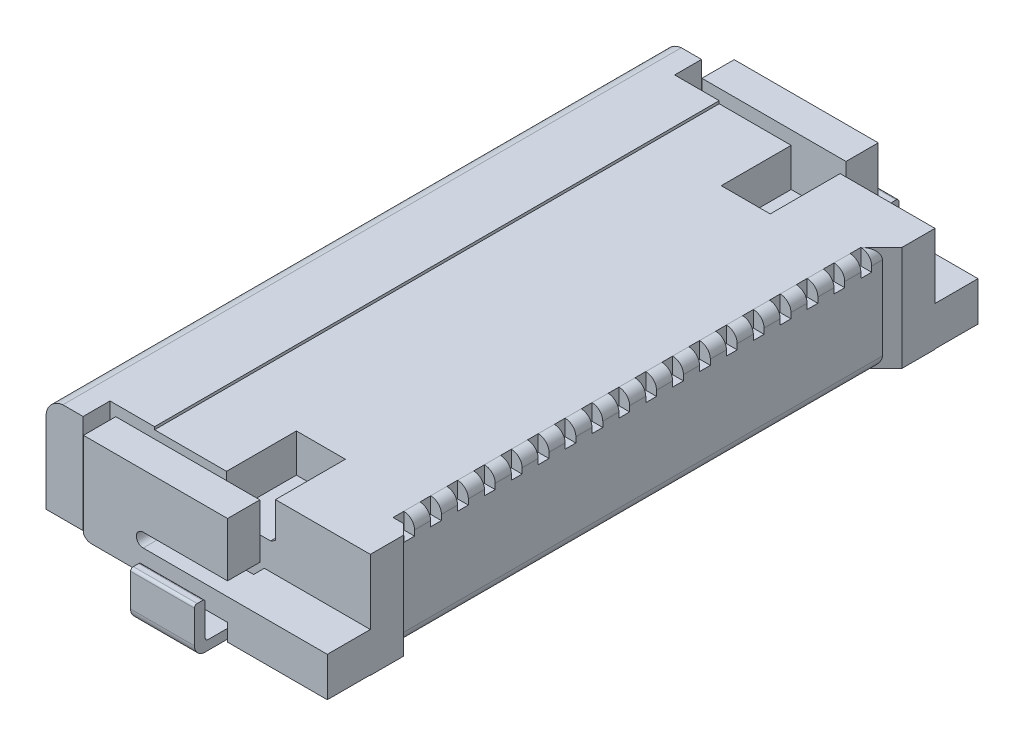
from build123d import *

# Parameters (mm, degrees)
BOSS_EXTRUDE1_DEPTH  = 0.6
BOSS_EXTRUDE2_DEPTH  = 0.8
SKETCH8_W            = 1.187106534
SKETCH8_H            = 0.413578876
BOSS_EXTRUDE3_DEPTH  = 0.6
BOSS_EXTRUDE5_DEPTH  = 1.999195913
CUT_EXTRUDE6_DEPTH   = 1.3
SKETCH19_W           = 5.25
SKETCH19_H           = 1.999195913
BOSS_EXTRUDE6_DEPTH  = 0.963004
BOSS_EXTRUDE7_DEPTH  = 5.25
CUT_EXTRUDE7_DEPTH   = 5.25
BOSS_EXTRUDE8_DEPTH  = 0.5
CUT_EXTRUDE8_DEPTH   = 0.05
FILLET4_R            = 0.2
BOSS_EXTRUDE9_DEPTH  = 0.5
SKETCH27_W           = 1.187106534
SKETCH27_H           = 0.682337146
BOSS_EXTRUDE10_DEPTH = 0.2
FILLET6_R            = 0.2
FILLET7_R            = 0.05
BOSS_EXTRUDE11_DEPTH = 1.187106534
FILLET6_OF_MIRROR6_R = 0.2
FILLET7_OF_MIRROR6_R = 0.05
FILLET8_R            = 0.05
FILLET9_R            = 0.05
SKETCH34_W           = 1.386527719
SKETCH34_H           = 0.2
CUT_EXTRUDE9_DEPTH   = 0.3
CUT_EXTRUDE10_DEPTH  = 0.68797799
SKETCH37_W           = 0.2
SKETCH37_H           = 0.52
BOSS_EXTRUDE12_DEPTH = 0.05
SKETCH38_W           = 0.2
SKETCH38_H           = 0.170876034
BOSS_EXTRUDE13_DEPTH = 0.01
LPATTERN2_COUNT      = 18
LPATTERN2_PITCH      = 0.5


with BuildPart() as part:
    # Sketch5 → Boss-Extrude1 (new body)
    with BuildSketch(Plane.XY):
        with BuildLine():
            Line((1.03647469, 0.909619652), (1.03647469, 0.476981472))
            add(Edge.make_bspline(
                [(1.184733339, 0.385802819), (1.081992039, 0.388557453), (1.03647469, 0.476981472)],
                knots=[0, 0, 0, 1, 1, 1], degree=2))
            Line((1.184733339, 0.385802819), (2.412634415, 0.385802819))
            Line((2.412634415, 0.385802819), (2.412634415, 0.799381695))
            Line((2.412634415, 0.799381695), (2.14625929, 0.799381695))
            ThreePointArc((2.14625929, 0.799381695), (2.018862492, 0.926778494), (2.14625929, 1.054175292))
            Line((2.14625929, 1.054175292), (3.715556221, 1.054175292))
            Line((3.715556221, 1.054175292), (3.715556221, 1.297888432))
            Line((3.715556221, 1.297888432), (3.715556221, 2.059195913))
            Line((3.715556221, 2.059195913), (1.03647469, 2.059195913))
            Line((1.03647469, 2.059195913), (1.03647469, 1.21340623))
            Line((1.03647469, 1.21340623), (1.03647469, 0.909619652))
        make_face()
    boss_extrude1 = extrude(amount=-BOSS_EXTRUDE1_DEPTH)



with BuildPart() as body_2:
    # Sketch7 → Boss-Extrude2 (new body)
    with BuildSketch(Plane.XY):
        Polygon((3.715556221, 0.067073076), (5.570517707, 0.067073076), (5.570517707, 0.174952185), (5.570517707, 0.799381695), (3.599740949, 0.799381695), (3.599740949, 0.385802819), (3.715556221, 0.385802819), (3.715556221, 0.174952185), align=None)
    boss_extrude2 = extrude(amount=-BOSS_EXTRUDE2_DEPTH)


with BuildPart() as part_1:
    add(part.part)

    add(body_2.part)  # Boss-Extrude3 merges body 2
    # Sketch8 → Boss-Extrude3 (add)
    with BuildSketch(Plane.XY):
        with Locations((3.006187682, 0.592592257)):
            Rectangle(SKETCH8_W, SKETCH8_H)
    boss_extrude3 = extrude(amount=-BOSS_EXTRUDE3_DEPTH)

    # Sketch13 → Boss-Extrude5 (add)
    with BuildSketch(Plane(origin=(0, 0.06, 0), x_dir=(1, 0, 0), z_dir=(0, 1, 0))):
        Polygon((5.307650665, 6.05), (1.692449276, 6.05), (1.692449276, 0.8), (5.570517707, 0.8), (5.570517707, 1.413103506), (5.3880831, 1.595538113), (5.3880831, 6.05), align=None)
    boss_extrude5 = extrude(amount=BOSS_EXTRUDE5_DEPTH)

    # Sketch17 → Cut-Extrude6 (cut)
    with BuildSketch(Plane.XY.offset(-0.8)):
        Polygon((3.806395908, 1.34820616), (3.715556221, 1.297888432), (2.896280475, 1.297888432), (2.896280475, 2.059195913), (3.806395908, 2.059195913), align=None)
    cut_extrude6 = extrude(amount=-CUT_EXTRUDE6_DEPTH, mode=Mode.SUBTRACT)



with BuildPart() as body_2_2:
    # Sketch19 → Boss-Extrude6 (new body)
    with BuildSketch(Plane.ZY.offset(-1.692449276)):
        with Locations((-3.425, 1.059597956)):
            Rectangle(SKETCH19_W, SKETCH19_H)
    boss_extrude6 = extrude(amount=BOSS_EXTRUDE6_DEPTH)

    # Sketch18 → Boss-Extrude7 (add)
    with BuildSketch(Plane.XY.offset(-0.8)):
        with BuildLine():
            Line((0.041467015, 1.670216776), (0.041467015, 0.219865316))
            Line((0.041467015, 0.219865316), (0.729445005, 0.219865316))
            Line((0.729445005, 0.219865316), (0.729445005, 0.909619652))
            Line((0.729445005, 0.909619652), (0.729445005, 2.059195913))
            Line((0.729445005, 2.059195913), (0.352729657, 2.059195913))
            ThreePointArc((0.352729657, 2.059195913), (0.116538119, 1.929170948), (0.041467015, 1.670216776))
        make_face()
    boss_extrude7 = extrude(amount=-BOSS_EXTRUDE7_DEPTH)

    # Sketch20 → Cut-Extrude7 (cut)
    with BuildSketch(Plane.XY.offset(-0.8)):
        Polygon((1.03647469, 0.067073076), (1.03647469, 0.909619652), (0.729445005, 0.909619652), (0.729445005, 0.219865316), (0.729445005, 0.06), (0.729445005, -0.020267982), (1.03647469, -0.020267982), align=None)
    cut_extrude7 = extrude(amount=-CUT_EXTRUDE7_DEPTH, mode=Mode.SUBTRACT)

    # Sketch21 → Boss-Extrude8 (add)
    with BuildSketch(Plane.XY.offset(-0.8)):
        with BuildLine():
            Line((0.729445005, 0.219865316), (0.729445005, 0.909619652))
            Line((0.729445005, 0.909619652), (0.729445005, 2.059195913))
            Line((0.729445005, 2.059195913), (0.352729657, 2.059195913))
            ThreePointArc((0.352729657, 2.059195913), (0.116538119, 1.929170948), (0.041467015, 1.670216776))
            Line((0.041467015, 1.670216776), (0.041467015, 0.219865316))
            Line((0.041467015, 0.219865316), (0.729445005, 0.219865316))
        make_face()
    boss_extrude8 = extrude(amount=BOSS_EXTRUDE8_DEPTH)


with BuildPart() as part_2:
    add(part_1.part)

    add(body_2_2.part)  # Mirror1 merges body 2 2
    # Mirror1: Boss-Extrude1, Boss-Extrude2, Boss-Extrude3, Boss-Extrude5 across Plane3
    add(boss_extrude1.mirror(Plane.XY.offset(-6.05)))
    add(boss_extrude2.mirror(Plane.XY.offset(-6.05)))
    add(boss_extrude3.mirror(Plane.XY.offset(-6.05)))
    add(boss_extrude5.mirror(Plane.XY.offset(-6.05)))

    # Mirror1 2: Cut-Extrude6 across Plane3
    add(cut_extrude6.mirror(Plane.XY.offset(-6.05)), mode=Mode.SUBTRACT)

    # Mirror1 3: Boss-Extrude6, Boss-Extrude7 across Plane3
    add(boss_extrude6.mirror(Plane.XY.offset(-6.05)))
    add(boss_extrude7.mirror(Plane.XY.offset(-6.05)))

    # Mirror1 4: Cut-Extrude7 across Plane3
    add(cut_extrude7.mirror(Plane.XY.offset(-6.05)), mode=Mode.SUBTRACT)

    # Mirror1 5: Boss-Extrude8 across Plane3
    add(boss_extrude8.mirror(Plane.XY.offset(-6.05)))

    # Sketch22 → Cut-Extrude8 (cut)
    with BuildSketch(Plane(origin=(0, 2.059195913, 0), x_dir=(1, 0, 0), z_dir=(0, 1, 0))):
        Polygon((2.896280475, 11.3), (1.558180163, 11.3), (1.558180163, 0.8), (2.896280475, 0.8), (2.896280475, 2.1), (3.806395908, 2.1), (3.806395908, 0.8), (5.570517707, 0.8), (5.570517707, 1.413103506), (5.3880831, 1.595538113), (5.3880831, 10.504461887), (5.570517707, 10.686896494), (5.570517707, 11.3), (3.806395908, 11.3), (3.806395908, 10), (2.896280475, 10), align=None)
    extrude(amount=-CUT_EXTRUDE8_DEPTH, mode=Mode.SUBTRACT)

    # Fillet4
    fillet4_edges = [part_2.edges().sort_by_distance(p)[0] for p in [
        (5.3880831, 0.06, -6.05),
        (5.3880831, 2.009195913, -6.05),
    ]]
    fillet(fillet4_edges, radius=FILLET4_R)



with BuildPart() as body_2_3:
    # Sketch26 → Boss-Extrude9 (new body)
    with BuildSketch(Plane.XY):
        Polygon((2.412634415, 0.174952185), (2.412634415, 0.067073076), (2.412634415, 0), (3.599740949, 0), (3.599740949, 0.067073076), (3.599740949, 0.174952185), align=None)
    boss_extrude9 = extrude(amount=BOSS_EXTRUDE9_DEPTH)

    # Sketch27 → Boss-Extrude10 (add)
    with BuildSketch(Plane.XY.offset(0.5)):
        with Locations((3.006187682, 0.516120758)):
            Rectangle(SKETCH27_W, SKETCH27_H)
    boss_extrude10 = extrude(amount=-BOSS_EXTRUDE10_DEPTH)

    # Fillet6
    fillet6_edges = [body_2_3.edges().sort_by_distance(p)[0] for p in [
        (3.006187682, 0, 0.5),
    ]]
    fillet(fillet6_edges, radius=FILLET6_R)

    # Fillet7
    fillet7_edges = [body_2_3.edges().sort_by_distance(p)[0] for p in [
        (3.006187682, 0.857289331, 0.3),
        (3.006187682, 0.857289331, 0.5),
    ]]
    fillet(fillet7_edges, radius=FILLET7_R)


with BuildPart() as part_3:
    add(part_2.part)

    add(body_2_3.part)  # Boss-Extrude11 merges body 2 3
    # Sketch28 → Boss-Extrude11 (add)
    with BuildSketch(Plane.ZY.offset(-2.412634415)):
        with BuildLine():
            Line((-0.8, 0.323306936), (-0.8, 0.139277214))
            ThreePointArc((-0.8, 0.139277214), (-0.690012763, 0.045403916), (-0.552725208, 0))
            Line((-0.552725208, 0), (0, 0))
            Line((0, 0), (0, 0.174952185))
            Line((0, 0.174952185), (-0.552725208, 0.174952185))
            ThreePointArc((-0.552725208, 0.174952185), (-0.689100625, 0.227898076), (-0.8, 0.323306936))
        make_face()
    boss_extrude11 = extrude(amount=-BOSS_EXTRUDE11_DEPTH)

    # Mirror6: Boss-Extrude9, Boss-Extrude10, Boss-Extrude11 across plane
    add(boss_extrude9.mirror(Plane.XY.offset(-6.05)))
    add(boss_extrude10.mirror(Plane.XY.offset(-6.05)))
    add(boss_extrude11.mirror(Plane.XY.offset(-6.05)))

    # Fillet6 of Mirror6
    fillet6_of_mirror6_edges = [part_3.edges().sort_by_distance(p)[0] for p in [
        (3.006187682, 0, -12.6),
    ]]
    fillet(fillet6_of_mirror6_edges, radius=FILLET6_OF_MIRROR6_R)

    # Fillet7 of Mirror6
    fillet7_of_mirror6_edges = [part_3.edges().sort_by_distance(p)[0] for p in [
        (3.006187682, 0.857289331, -12.4),
        (3.006187682, 0.857289331, -12.6),
    ]]
    fillet(fillet7_of_mirror6_edges, radius=FILLET7_OF_MIRROR6_R)

    # Fillet8
    fillet8_edges = [part_3.edges().sort_by_distance(p)[0] for p in [
        (3.006187682, 0.174952185, 0.3),
    ]]
    fillet(fillet8_edges, radius=FILLET8_R)

    # Fillet9
    fillet9_edges = [part_3.edges().sort_by_distance(p)[0] for p in [
        (3.006187682, 0.174952185, -12.4),
    ]]
    fillet(fillet9_edges, radius=FILLET9_R)

    # Sketch34 → Cut-Extrude9 (cut)
    with BuildSketch(Plane(origin=(0, 2.009195913, 0), x_dir=(1, 0, 0), z_dir=(0, 1, 0))):
        with Locations((5.88134696, 9.704461887)):
            Rectangle(SKETCH34_W, SKETCH34_H)
        with Locations((5.88134696, 10.204461887)):
            Rectangle(SKETCH34_W, SKETCH34_H)
        with Locations((5.88134696, 9.204461887)):
            Rectangle(SKETCH34_W, SKETCH34_H)
        with Locations((5.88134696, 8.704461887)):
            Rectangle(SKETCH34_W, SKETCH34_H)
        with Locations((5.88134696, 8.204461887)):
            Rectangle(SKETCH34_W, SKETCH34_H)
        with Locations((5.88134696, 7.704461887)):
            Rectangle(SKETCH34_W, SKETCH34_H)
        with Locations((5.88134696, 7.204461887)):
            Rectangle(SKETCH34_W, SKETCH34_H)
        with Locations((5.88134696, 6.704461887)):
            Rectangle(SKETCH34_W, SKETCH34_H)
        with Locations((5.88134696, 6.204461887)):
            Rectangle(SKETCH34_W, SKETCH34_H)
        with Locations((5.88134696, 5.704461887)):
            Rectangle(SKETCH34_W, SKETCH34_H)
        with Locations((5.88134696, 5.204461887)):
            Rectangle(SKETCH34_W, SKETCH34_H)
        with Locations((5.88134696, 4.704461887)):
            Rectangle(SKETCH34_W, SKETCH34_H)
        with Locations((5.88134696, 4.204461887)):
            Rectangle(SKETCH34_W, SKETCH34_H)
        with Locations((5.88134696, 3.704461887)):
            Rectangle(SKETCH34_W, SKETCH34_H)
        with Locations((5.88134696, 3.204461887)):
            Rectangle(SKETCH34_W, SKETCH34_H)
        with Locations((5.88134696, 2.704461887)):
            Rectangle(SKETCH34_W, SKETCH34_H)
        with Locations((5.88134696, 2.204461887)):
            Rectangle(SKETCH34_W, SKETCH34_H)
        with Locations((5.88134696, 1.704461887)):
            Rectangle(SKETCH34_W, SKETCH34_H)
    extrude(amount=-CUT_EXTRUDE9_DEPTH, mode=Mode.SUBTRACT)

    # Sketch35 → Cut-Extrude10 (cut)
    with BuildSketch(Plane.ZY.offset(-0.041467015)):
        Polygon((-10.835, 0.219865316), (-10.835, 0.909619652), (-9.505, 0.909619652), (-9.505, 1.229619652), (-2.595, 1.229619652), (-2.595, 0.909619652), (-1.265, 0.909619652), (-1.265, 0.219865316), align=None)
    extrude(amount=-CUT_EXTRUDE10_DEPTH, mode=Mode.SUBTRACT)

    # Sketch37 → Boss-Extrude12 (add)
    with BuildSketch(Plane.ZY.offset(-1.03647469)):
        with Locations((-10.285, 0.649619652)):
            Rectangle(SKETCH37_W, SKETCH37_H)
        with Locations((-9.785, 0.649619652)):
            Rectangle(SKETCH37_W, SKETCH37_H)
        with Locations((-9.285, 0.649619652)):
            Rectangle(SKETCH37_W, SKETCH37_H)
        with Locations((-8.785, 0.649619652)):
            Rectangle(SKETCH37_W, SKETCH37_H)
        with Locations((-8.285, 0.649619652)):
            Rectangle(SKETCH37_W, SKETCH37_H)
        with Locations((-7.785, 0.649619652)):
            Rectangle(SKETCH37_W, SKETCH37_H)
        with Locations((-7.285, 0.649619652)):
            Rectangle(SKETCH37_W, SKETCH37_H)
        with Locations((-6.785, 0.649619652)):
            Rectangle(SKETCH37_W, SKETCH37_H)
        with Locations((-6.285, 0.649619652)):
            Rectangle(SKETCH37_W, SKETCH37_H)
        with Locations((-5.785, 0.649619652)):
            Rectangle(SKETCH37_W, SKETCH37_H)
        with Locations((-5.285, 0.649619652)):
            Rectangle(SKETCH37_W, SKETCH37_H)
        with Locations((-4.785, 0.649619652)):
            Rectangle(SKETCH37_W, SKETCH37_H)
        with Locations((-4.285, 0.649619652)):
            Rectangle(SKETCH37_W, SKETCH37_H)
        with Locations((-3.785, 0.649619652)):
            Rectangle(SKETCH37_W, SKETCH37_H)
        with Locations((-3.285, 0.649619652)):
            Rectangle(SKETCH37_W, SKETCH37_H)
        with Locations((-1.785, 0.649619652)):
            Rectangle(SKETCH37_W, SKETCH37_H)
        with Locations((-2.285, 0.649619652)):
            Rectangle(SKETCH37_W, SKETCH37_H)
        with Locations((-2.785, 0.649619652)):
            Rectangle(SKETCH37_W, SKETCH37_H)
    extrude(amount=BOSS_EXTRUDE12_DEPTH)

    # Sketch38 → Boss-Extrude13 (add)
    with BuildSketch(Plane.ZY.offset(-0.98647469)):
        with Locations((-10.285, 0.735057669)):
            Rectangle(SKETCH38_W, SKETCH38_H)
    boss_extrude13 = extrude(amount=BOSS_EXTRUDE13_DEPTH)

    # LPattern2: Boss-Extrude13 ×18
    with Locations(*[(0, 0, i * LPATTERN2_PITCH) for i in range(1, LPATTERN2_COUNT)]):
        add(boss_extrude13)


solid = part_3.part
